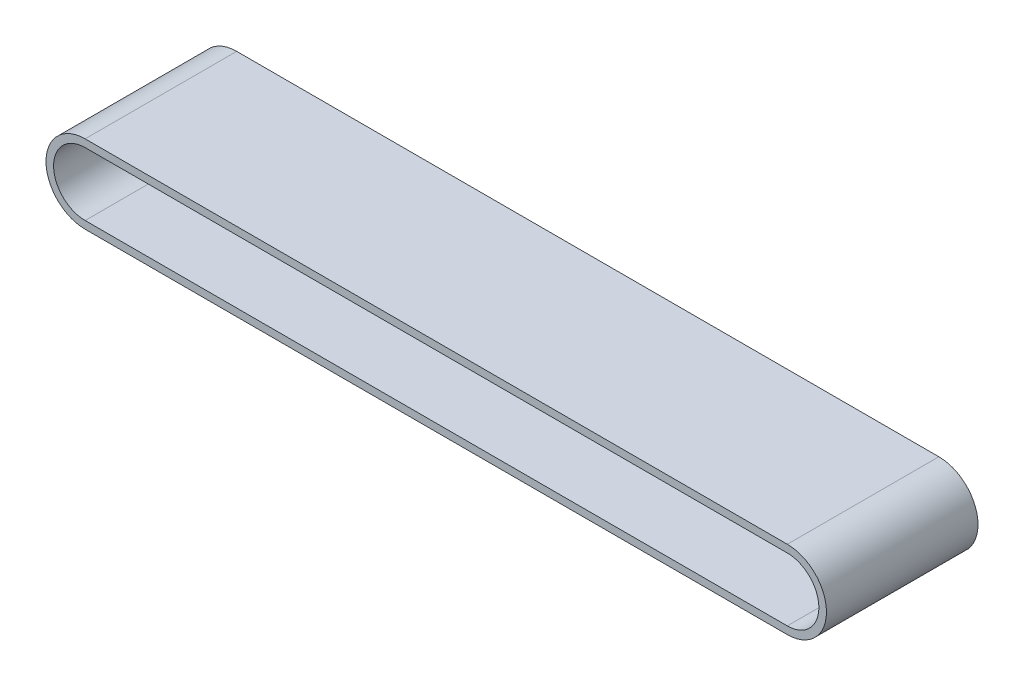
from build123d import *

# Parameters (mm, degrees)
SALIENTE_EXTRUIR2_DEPTH = 60


with BuildPart() as part:
    # Croquis2 → Saliente-Extruir2 (new body)
    with BuildSketch(Plane.XY):
        with BuildLine():
            Line((-29.712041885, 28), (248.287958115, 28))
            ThreePointArc((248.287958115, 28), (263.787958115, 12.5), (248.287958115, -3))
            Line((248.287958115, -3), (-29.712041885, -3))
            ThreePointArc((-29.712041885, -3), (-45.212041885, 12.5), (-29.712041885, 28))
        make_face()
        with BuildLine():
            Line((-29.712041885, 25), (248.287958115, 25))
            ThreePointArc((248.287958115, 25), (260.787958115, 12.5), (248.287958115, 0))
            Line((248.287958115, 0), (-29.712041885, 0))
            ThreePointArc((-29.712041885, 0), (-42.212041885, 12.5), (-29.712041885, 25))
        make_face(mode=Mode.SUBTRACT)
    extrude(amount=SALIENTE_EXTRUIR2_DEPTH)


solid = part.part
